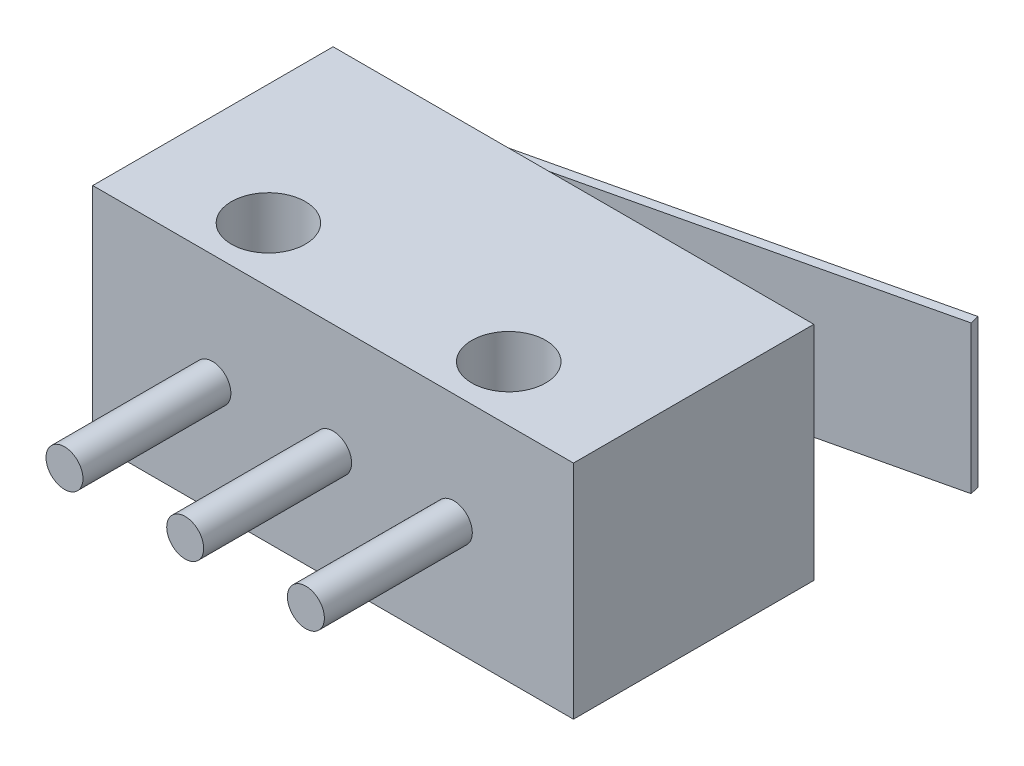
from build123d import *

# Parameters (mm, degrees)
SKETCH_1_W        = 13
SKETCH_1_H        = 6.5
SKETCH_1_R        = 1
EXTRUDE_1_DEPTH   = 3
SKETCH_2_R        = 0.5
EXTRUDE_2_DEPTH   = 4
EXTRUDE_1_2_DEPTH = 2


with BuildPart() as part:
    # Эскиз1 → Extrude 1 (new, symmetric)
    with BuildSketch(Plane(origin=(0, 0, 0), x_dir=(1, 0, 0), z_dir=(0, 1, 0))):
        Rectangle(SKETCH_1_W, SKETCH_1_H)
        with Locations(Location((3.25, -1.75, 0), (0, 0, 270))):
            Circle(SKETCH_1_R, mode=Mode.SUBTRACT)
        with Locations(Location((-3.25, -1.75, 0), (0, 0, 90))):
            Circle(SKETCH_1_R, mode=Mode.SUBTRACT)
    extrude(amount=EXTRUDE_1_DEPTH, both=True)

    # Эскиз2 → Бобышка-Вытянуть2 (add)
    with BuildSketch(Plane.XY.offset(3.25)):
        with Locations(Location((-3.264227948, 0, 0), (0, 0, 180))):
            Circle(SKETCH_2_R)
        with Locations(Location((0, 0, 0), (0, 0, 180))):
            Circle(SKETCH_2_R)
        with Locations(Location((3.264227948, 0, 0), (0, 0, 180))):
            Circle(SKETCH_2_R)
    extrude(amount=EXTRUDE_2_DEPTH)

    # Эскиз3 → Extrude 1 2 (add, symmetric)
    with BuildSketch(Plane(origin=(0, 0, 0), x_dir=(1, 0, 0), z_dir=(0, 1, 0))):
        Polygon((-6.471609365, 3.1282668), (7.594638597, 6.4087992), (7.537857328, 6.6522656), (-6.528390635, 3.3717332), align=None)
    extrude(amount=EXTRUDE_1_2_DEPTH, both=True)


solid = part.part
